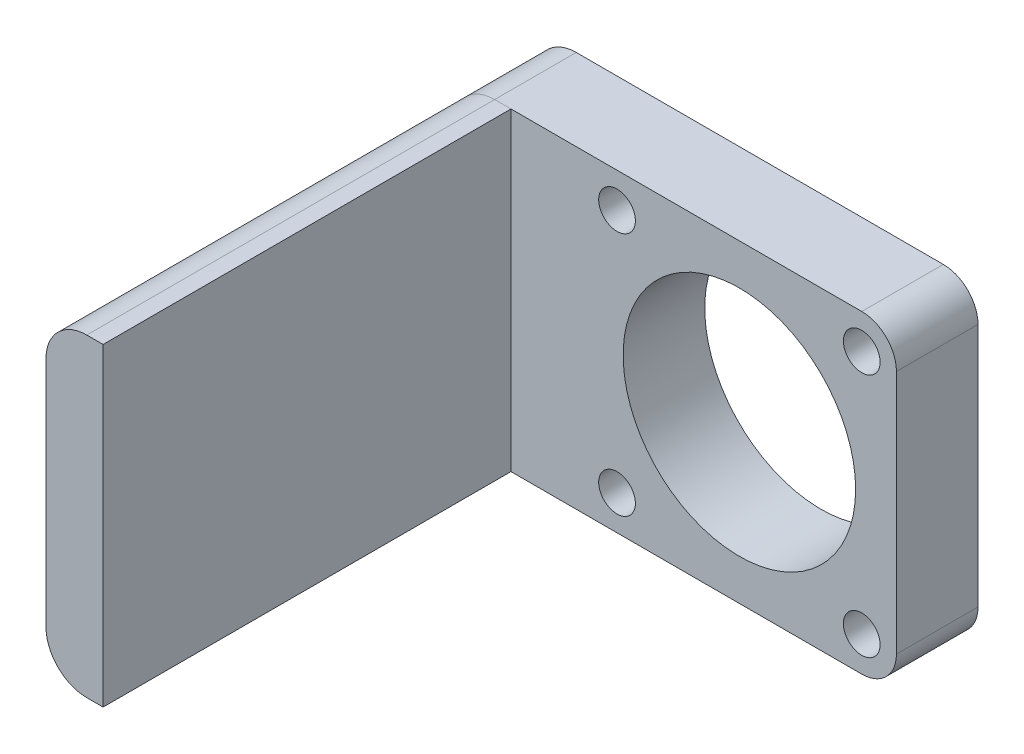
from build123d import *

# Parameters (mm, degrees)
SKETCH1_R           = 2.25
SKETCH1_R_2         = 14.25
BOSS_EXTRUDE1_DEPTH = 10
BOSS_EXTRUDE3_DEPTH = 50


with BuildPart() as part:
    # Sketch1 → Boss-Extrude1 (new body)
    with BuildSketch(Plane.XY):
        with BuildLine():
            Line((15, 19.25), (-15, 19.25))
            Line((-15, 19.25), (-30, 19.25))
            ThreePointArc((-30, 19.25), (-33.535533906, 17.785533906), (-35, 14.25))
            Line((-35, 14.25), (-35, -14.25))
            ThreePointArc((-35, -14.25), (-33.535533906, -17.785533906), (-30, -19.25))
            Line((-30, -19.25), (-15, -19.25))
            Line((-15, -19.25), (15, -19.25))
            ThreePointArc((15, -19.25), (18.00520382, -18.00520382), (19.25, -15))
            Line((19.25, -15), (19.25, 15))
            ThreePointArc((19.25, 15), (18.00520382, 18.00520382), (15, 19.25))
        make_face()
        with Locations((-15, -15)):
            Circle(SKETCH1_R, mode=Mode.SUBTRACT)
        with Locations((15, -15)):
            Circle(SKETCH1_R, mode=Mode.SUBTRACT)
        with Locations((-15, 15)):
            Circle(SKETCH1_R, mode=Mode.SUBTRACT)
        Circle(SKETCH1_R_2, mode=Mode.SUBTRACT)
        with Locations((15, 15)):
            Circle(SKETCH1_R, mode=Mode.SUBTRACT)
    extrude(amount=BOSS_EXTRUDE1_DEPTH)


with BuildPart() as body_2:
    # Sketch2 → Boss-Extrude3 (new body)
    with BuildSketch(Plane.XY.offset(10)):
        with BuildLine():
            Line((-30, -19.25), (-28, -19.25))
            Line((-28, -19.25), (-28, 0))
            Line((-28, 0), (-28, 19.25))
            Line((-28, 19.25), (-30, 19.25))
            ThreePointArc((-30, 19.25), (-33.535533906, 17.785533906), (-35, 14.25))
            Line((-35, 14.25), (-35, -14.25))
            ThreePointArc((-35, -14.25), (-33.535533906, -17.785533906), (-30, -19.25))
        make_face()
    extrude(amount=BOSS_EXTRUDE3_DEPTH)


solid = Compound([part.part, body_2.part])
